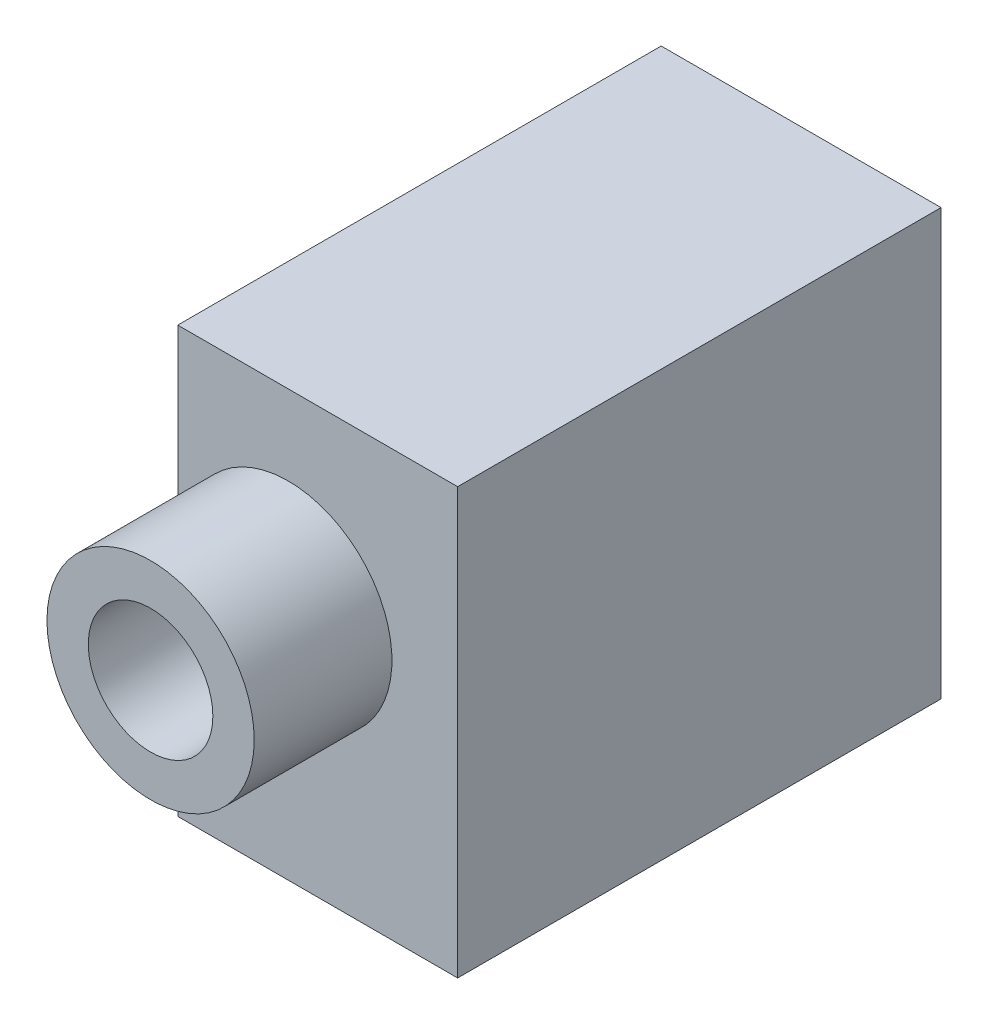
from build123d import *

# Parameters (mm, degrees)
SKETCH1_W           = 8.1026
SKETCH1_H           = 13.9954
BOSS_EXTRUDE1_DEPTH = 12.319
SKETCH2_R           = 3
SKETCH2_R_2         = 1.8034
BOSS_EXTRUDE2_DEPTH = 3.9878


with BuildPart() as part:
    # Sketch1 → Boss-Extrude1 (new body)
    with BuildSketch(Plane(origin=(0, 0, 0), x_dir=(1, 0, 0), z_dir=(0, 1, 0))):
        with Locations((0.8509, 6.9977)):
            Rectangle(SKETCH1_W, SKETCH1_H)
    extrude(amount=BOSS_EXTRUDE1_DEPTH)

    # Sketch2 → Boss-Extrude2 (add)
    with BuildSketch(Plane.XY):
        with Locations(Location((0, 7.0104, 0), (0, 0, 180))):
            Circle(SKETCH2_R)
        with Locations((0, 7.0104)):
            Circle(SKETCH2_R_2, mode=Mode.SUBTRACT)
    extrude(amount=BOSS_EXTRUDE2_DEPTH)


solid = part.part
